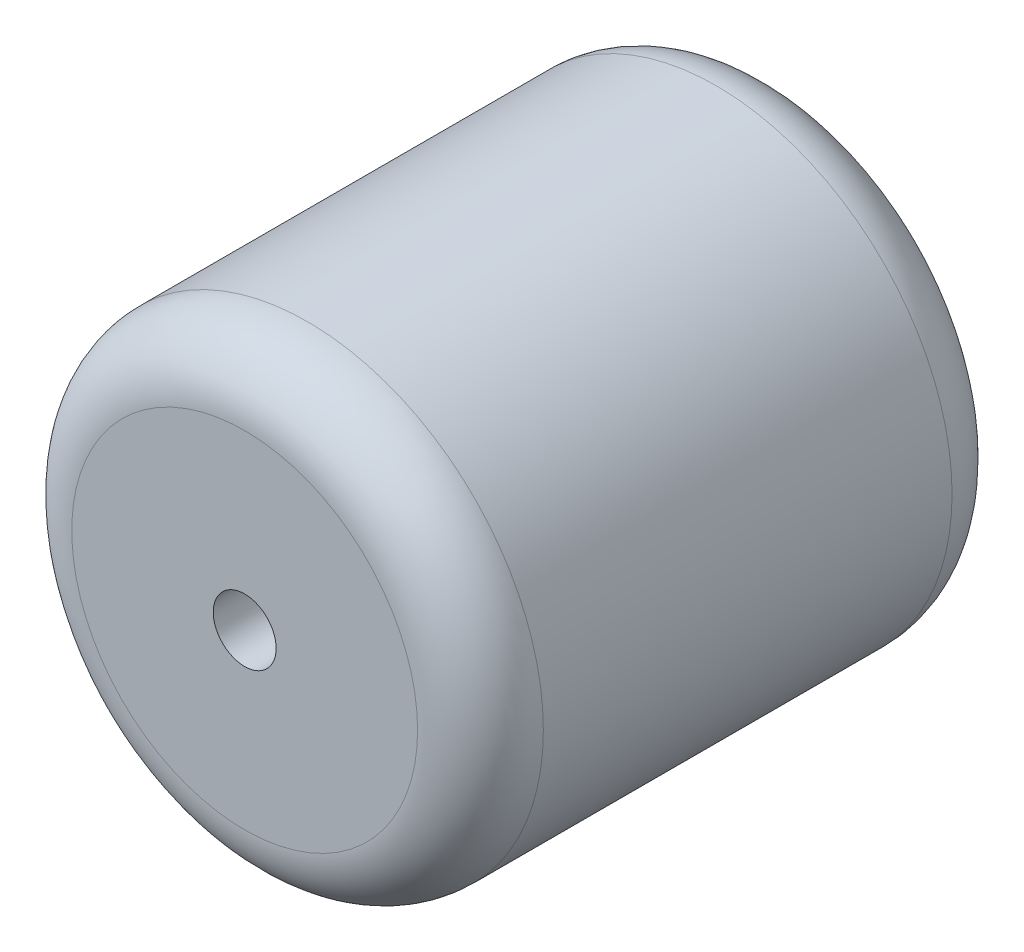
from build123d import *

# Parameters (mm, degrees)
SKETCH3_R           = 7.5
BOSS_EXTRUDE2_DEPTH = 17
SKETCH5_R           = 1
CUT_EXTRUDE1_DEPTH  = 17
FILLET5_R           = 2
FILLET6_R           = 2


with BuildPart() as part:
    # Sketch3 → Boss-Extrude2 (new body)
    with BuildSketch(Plane.XY):
        Circle(SKETCH3_R)
    extrude(amount=BOSS_EXTRUDE2_DEPTH)

    # Sketch5 → Cut-Extrude1 (cut)
    with BuildSketch(Plane.XY.offset(17)):
        Circle(SKETCH5_R)
    extrude(amount=-CUT_EXTRUDE1_DEPTH, mode=Mode.SUBTRACT)

    # Fillet5
    fillet5_edges = [part.edges().sort_by_distance(p)[0] for p in [
        (-7.5, 0, 17),
    ]]
    fillet(fillet5_edges, radius=FILLET5_R)

    # Fillet6
    fillet6_edges = [part.edges().sort_by_distance(p)[0] for p in [
        (-7.5, 0, 0),
    ]]
    fillet(fillet6_edges, radius=FILLET6_R)


solid = part.part
